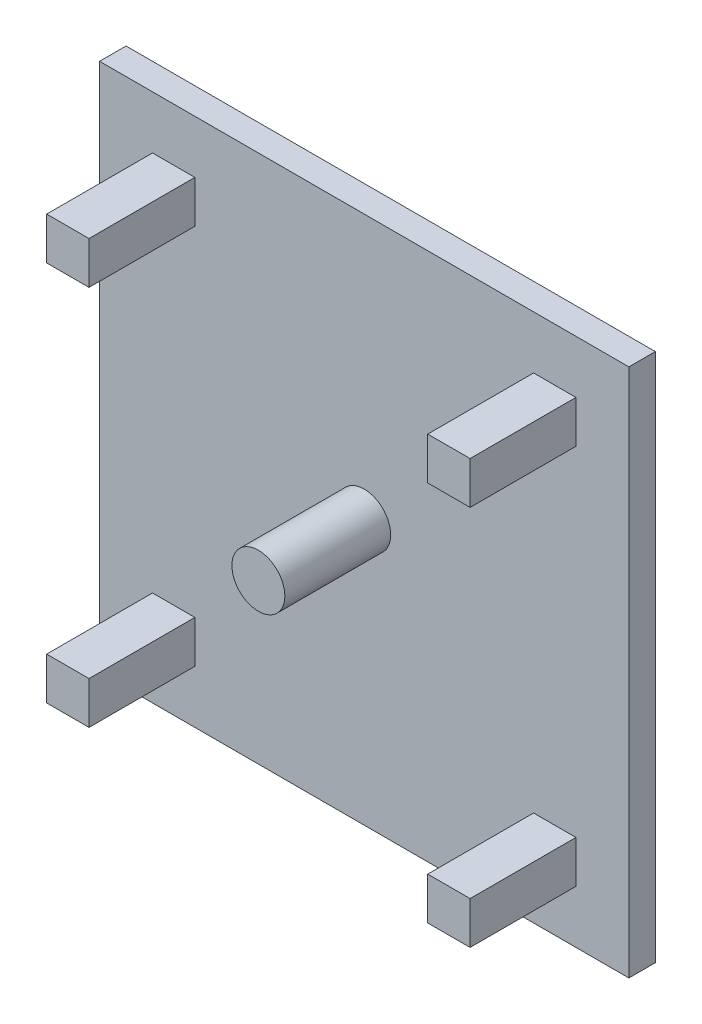
from build123d import *

# Parameters (mm, degrees)
SKETCH_1_W          = 100
SKETCH_1_H          = 100
EXTRUDE_1_DEPTH     = 25
SKETCH_2_W          = 100
SKETCH_2_H          = 100
SKETCH_2_W_2        = 8
SKETCH_2_H_2        = 8
CUT_EXTRUDE_1_DEPTH = 20
EXTRUDE_2_REACH     = 145.614
SKETCH_3_R          = 5


with BuildPart() as part:
    # 草图1 → 凸台-拉伸1 (new body)
    with BuildSketch(Plane.XY):
        with Locations((50, 50)):
            Rectangle(SKETCH_1_W, SKETCH_1_H)
    extrude(amount=EXTRUDE_1_DEPTH)

    # 草图2 → 切除-拉伸1 (cut)
    with BuildSketch(Plane.XY.offset(25)):
        with Locations((50, 50)):
            Rectangle(SKETCH_2_W, SKETCH_2_H)
        with Locations((14, 86)):
            Rectangle(SKETCH_2_W_2, SKETCH_2_H_2, mode=Mode.SUBTRACT)
        with Locations((86, 86)):
            Rectangle(SKETCH_2_W_2, SKETCH_2_H_2, mode=Mode.SUBTRACT)
        with Locations((14, 14)):
            Rectangle(SKETCH_2_W_2, SKETCH_2_H_2, mode=Mode.SUBTRACT)
        with Locations((86, 14)):
            Rectangle(SKETCH_2_W_2, SKETCH_2_H_2, mode=Mode.SUBTRACT)
    extrude(amount=-CUT_EXTRUDE_1_DEPTH, mode=Mode.SUBTRACT)

    # 草图3 → 凸台-拉伸2 (add, up to next)
    with BuildSketch(Plane.XY.offset(25), mode=Mode.PRIVATE) as extrude_2_sk1:
        with Locations((50, 50)):
            Circle(SKETCH_3_R)
    extrude_2_tool1 = extrude(extrude_2_sk1.sketch, amount=-EXTRUDE_2_REACH, mode=Mode.PRIVATE) - part.part
    add(extrude_2_tool1.solids().sort_by_distance((50, 50, 25))[0])


solid = part.part
